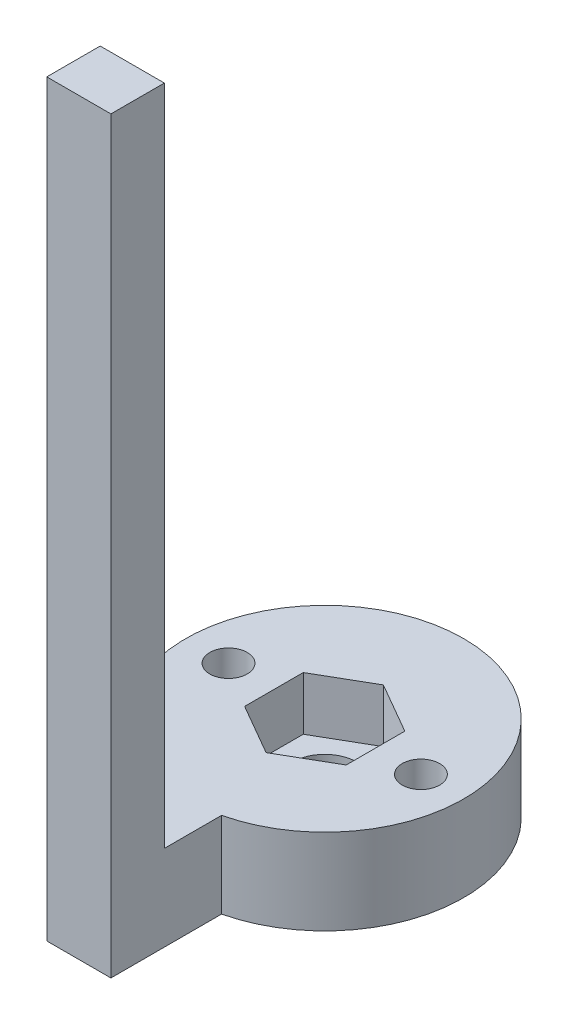
from build123d import *

# Parameters (mm, degrees)
SKETCH1_R           = 13
BOSS_EXTRUDE1_DEPTH = 8
CUT_EXTRUDE1_DEPTH  = 5
SKETCH3_R           = 1.75
CUT_EXTRUDE2_DEPTH  = 21.049937656
SKETCH4_R           = 3
CUT_EXTRUDE3_DEPTH  = 5
SKETCH6_R           = 3
CUT_EXTRUDE4_DEPTH  = 3
SKETCH7_R           = 3
CUT_EXTRUDE5_DEPTH  = 3
SKETCH5_W           = 8
SKETCH5_H           = 6
BOSS_EXTRUDE2_DEPTH = 5
SKETCH8_W           = 6
SKETCH8_H           = 70
BOSS_EXTRUDE3_DEPTH = 5


with BuildPart() as part:
    # Sketch1 → Boss-Extrude1 (new body)
    with BuildSketch(Plane(origin=(0, 0, 0), x_dir=(1, 0, 0), z_dir=(0, 1, 0))):
        with Locations(Location((0, 0, 0), (0, 0, 270))):
            Circle(SKETCH1_R)
    extrude(amount=BOSS_EXTRUDE1_DEPTH)

    # Sketch2 → Cut-Extrude1 (cut)
    with BuildSketch(Plane(origin=(0, 8, 0), x_dir=(1, 0, 0), z_dir=(0, 1, 0))):
        Polygon((0, 5.484827557), (-4.75, 2.742413779), (-4.75, -2.742413779), (0, -5.484827557), (4.75, -2.742413779), (4.75, 2.742413779), align=None)
    extrude(amount=-CUT_EXTRUDE1_DEPTH, mode=Mode.SUBTRACT)

    # Sketch3 → Cut-Extrude2 (cut, through all)
    with BuildSketch(Plane(origin=(0, 8, 0), x_dir=(1, 0, 0), z_dir=(0, 1, 0))):
        with Locations(Location((9, 0, 0), (0, 0, 270))):
            Circle(SKETCH3_R)
    cut_extrude2 = extrude(amount=-CUT_EXTRUDE2_DEPTH, mode=Mode.SUBTRACT)

    # Mirror1: Cut-Extrude2 across plane
    add(cut_extrude2.mirror(Plane(origin=(0, 0, 0), x_dir=(0, 0, 1), z_dir=(1, 0, 0))), mode=Mode.SUBTRACT)

    # Sketch4 → Cut-Extrude3 (cut)
    with BuildSketch(Plane(origin=(0, 3, 0), x_dir=(1, 0, 0), z_dir=(0, 1, 0))):
        with Locations(Location((0, 0, 0), (0, 0, 270))):
            Circle(SKETCH4_R)
    extrude(amount=-CUT_EXTRUDE3_DEPTH, mode=Mode.SUBTRACT)

    # Sketch6 → Cut-Extrude4 (cut)
    with BuildSketch(Plane.XZ):
        with Locations(Location((9, 0, 0), (0, 0, 270))):
            Circle(SKETCH6_R)
    extrude(amount=-CUT_EXTRUDE4_DEPTH, mode=Mode.SUBTRACT)

    # Sketch7 → Cut-Extrude5 (cut)
    with BuildSketch(Plane.XZ):
        with Locations(Location((-9, 0, 0), (0, 0, 270))):
            Circle(SKETCH7_R)
    extrude(amount=-CUT_EXTRUDE5_DEPTH, mode=Mode.SUBTRACT)

    # Sketch5 → Boss-Extrude2 (add, symmetric)
    with BuildSketch(Plane(origin=(0, 0, 13), x_dir=(0, -1, 0), z_dir=(0, 0, 1))):
        with Locations((-4, 0)):
            Rectangle(SKETCH5_W, SKETCH5_H)
    extrude(amount=BOSS_EXTRUDE2_DEPTH, both=True)

    # Sketch8 → Boss-Extrude3 (add)
    with BuildSketch(Plane.XY.offset(18)):
        with Locations((0, 35)):
            Rectangle(SKETCH8_W, SKETCH8_H)
    extrude(amount=BOSS_EXTRUDE3_DEPTH)


solid = part.part
